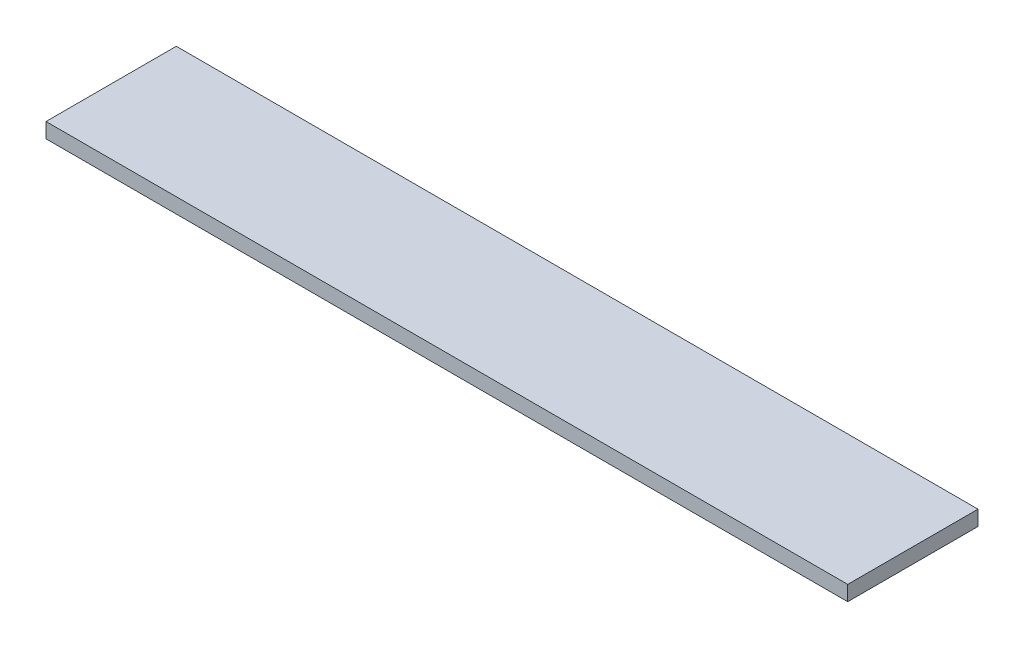
from build123d import *

# Parameters (mm, degrees)
SKETCH1_W           = 1016
SKETCH1_H           = 165.1
BOSS_EXTRUDE1_DEPTH = 19.05


with BuildPart() as part:
    # Sketch1 → Boss-Extrude1 (new body)
    with BuildSketch(Plane(origin=(0, 0, 0), x_dir=(1, 0, 0), z_dir=(0, 1, 0))):
        with Locations((364.194841509, -853.930181371)):
            Rectangle(SKETCH1_W, SKETCH1_H)
    extrude(amount=BOSS_EXTRUDE1_DEPTH)


solid = part.part
